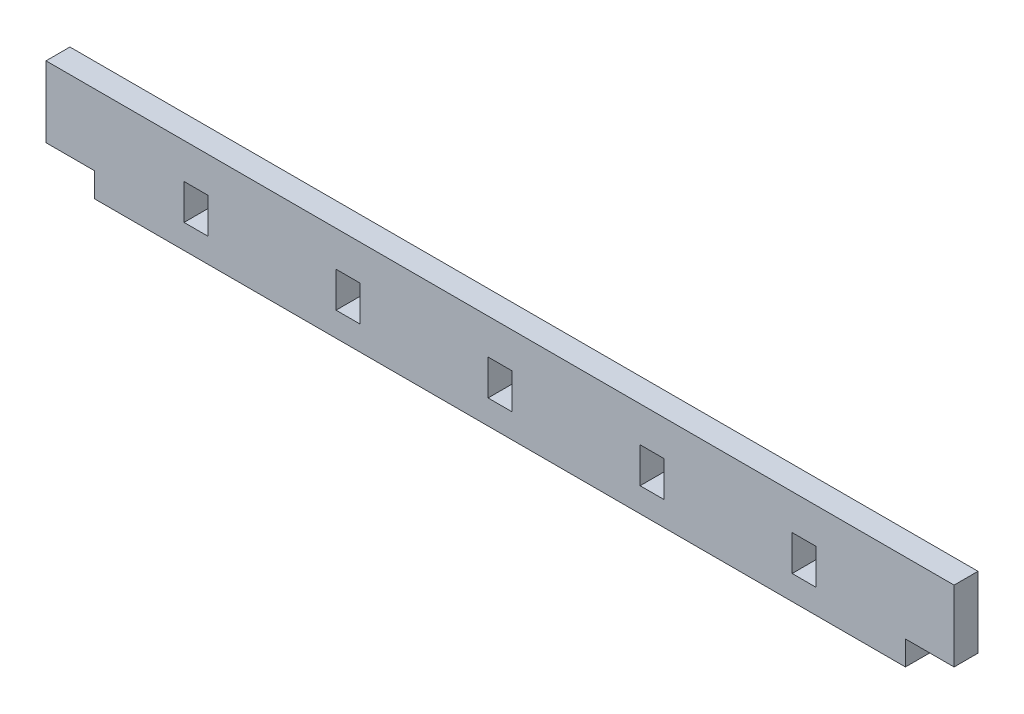
from build123d import *

# Parameters (mm, degrees)
SKETCH1_W           = 2.9972
SKETCH1_H           = 4.445
BOSS_EXTRUDE1_DEPTH = 2.9972


with BuildPart() as part:
    # Sketch1 → Boss-Extrude1 (new body)
    with BuildSketch(Plane.XY):
        Polygon((0, 19.2778), (0, 10.3878), (6.096, 10.3878), (6.096, 7.3398), (107.696, 7.3398), (107.696, 10.3878), (113.792, 10.3878), (113.792, 19.2778), (107.696, 19.2778), (6.096, 19.2778), align=None)
        with Locations((18.796, 12.6103)):
            Rectangle(SKETCH1_W, SKETCH1_H, mode=Mode.SUBTRACT)
        with Locations((37.846, 12.6103)):
            Rectangle(SKETCH1_W, SKETCH1_H, mode=Mode.SUBTRACT)
        with Locations((56.896, 12.6103)):
            Rectangle(SKETCH1_W, SKETCH1_H, mode=Mode.SUBTRACT)
        with Locations((75.946, 12.6103)):
            Rectangle(SKETCH1_W, SKETCH1_H, mode=Mode.SUBTRACT)
        with Locations((94.996, 12.6103)):
            Rectangle(SKETCH1_W, SKETCH1_H, mode=Mode.SUBTRACT)
    extrude(amount=BOSS_EXTRUDE1_DEPTH)


solid = part.part
